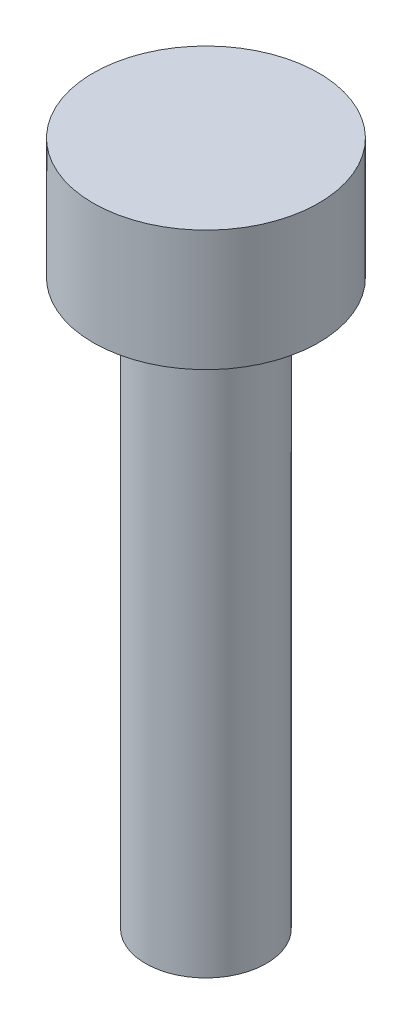
from build123d import *

# Parameters (mm, degrees)
SKETCH_1_R      = 2.8
EXTRUDE_1_DEPTH = 3
SKETCH_2_R      = 1.5
EXTRUDE_2_DEPTH = 14


with BuildPart() as part:
    # 草图1 → 凸台-拉伸1 (new body)
    with BuildSketch(Plane(origin=(0, 0, 0), x_dir=(1, 0, 0), z_dir=(0, 1, 0))):
        with Locations(Location((0, 0, 0), (0, 0, 270))):
            Circle(SKETCH_1_R)
    extrude(amount=EXTRUDE_1_DEPTH)

    # 草图2 → 凸台-拉伸2 (add)
    with BuildSketch(Plane.XZ):
        with Locations(Location((0, 0, 0), (0, 0, 270))):
            Circle(SKETCH_2_R)
    extrude(amount=EXTRUDE_2_DEPTH)


solid = part.part
